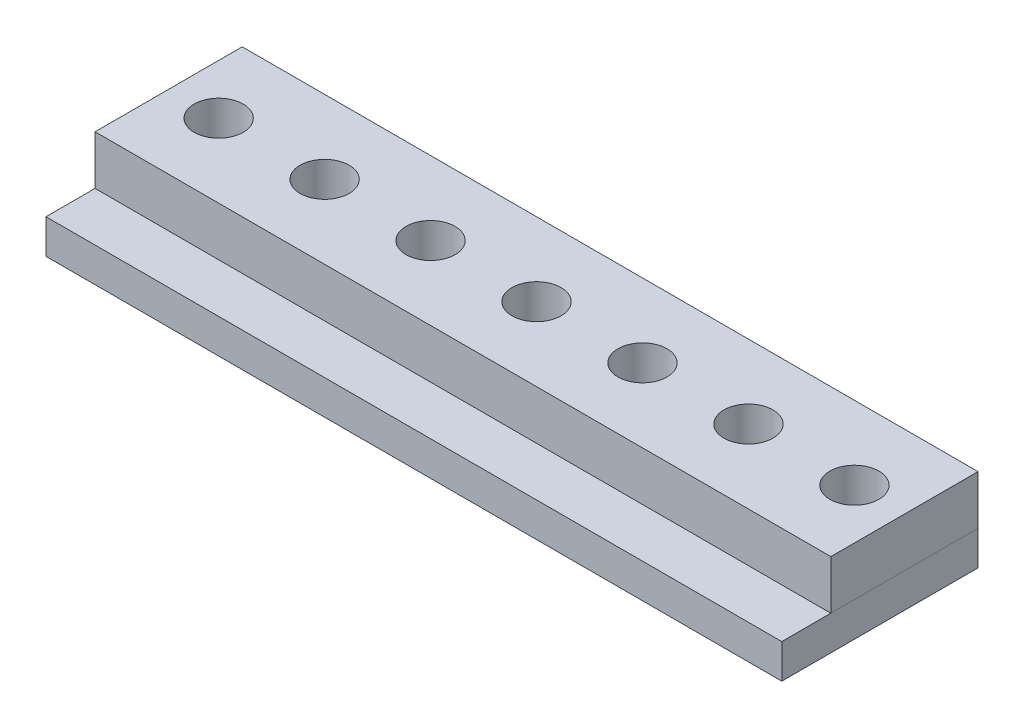
from build123d import *

# Parameters (mm, degrees)
SKETCH1_W           = 1500
SKETCH1_H           = 300
SKETCH1_R           = 50
BOSS_EXTRUDE1_DEPTH = 100
SKETCH2_W           = 1500
SKETCH2_H           = 400
BOSS_EXTRUDE3_DEPTH = 70


with BuildPart() as part:
    # Sketch1 → Boss-Extrude1 (new body)
    with BuildSketch(Plane(origin=(0, 0, 0), x_dir=(1, 0, 0), z_dir=(0, 1, 0))):
        Rectangle(SKETCH1_W, SKETCH1_H)
        with Locations(Location((-648, 0, 0), (0, 0, 270))):
            Circle(SKETCH1_R, mode=Mode.SUBTRACT)
        with Locations(Location((-432, 0, 0), (0, 0, 270))):
            Circle(SKETCH1_R, mode=Mode.SUBTRACT)
        with Locations(Location((-216, 0, 0), (0, 0, 270))):
            Circle(SKETCH1_R, mode=Mode.SUBTRACT)
        with Locations(Location((0, 0, 0), (0, 0, 270))):
            Circle(SKETCH1_R, mode=Mode.SUBTRACT)
        with Locations(Location((216, 0, 0), (0, 0, 270))):
            Circle(SKETCH1_R, mode=Mode.SUBTRACT)
        with Locations(Location((432, 0, 0), (0, 0, 270))):
            Circle(SKETCH1_R, mode=Mode.SUBTRACT)
        with Locations(Location((648, 0, 0), (0, 0, 270))):
            Circle(SKETCH1_R, mode=Mode.SUBTRACT)
    extrude(amount=BOSS_EXTRUDE1_DEPTH)


with BuildPart() as body_2:
    # Sketch2 → Boss-Extrude3 (new body)
    with BuildSketch(Plane.XZ):
        with Locations((0, 50)):
            Rectangle(SKETCH2_W, SKETCH2_H)
    extrude(amount=BOSS_EXTRUDE3_DEPTH)


solid = Compound([part.part, body_2.part])
